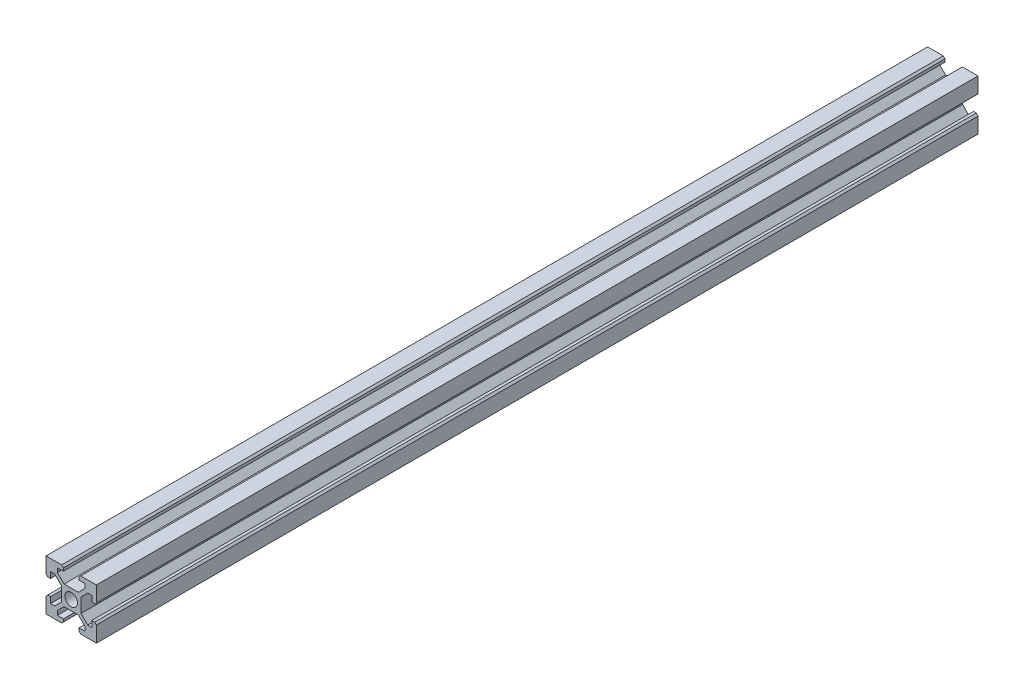
from build123d import *

# Parameters (mm, degrees)
SKETCH1_R           = 2.5
BOSS_EXTRUDE1_DEPTH = 175


with BuildPart() as part:
    # Sketch1 → Boss-Extrude1 (new, symmetric)
    with BuildSketch(Plane.XY):
        Polygon((3.9, -2.839339828), (6.560660172, -5.5), (8.200660172, -5.5), (8.200660172, -3.1), (9.3, -3.1), (10, -3.8), (10, -10), (3.8, -10), (3.1, -9.3), (3.1, -8.200660172), (5.5, -8.200660172), (5.5, -6.560660172), (2.839339828, -3.9), (-2.839339828, -3.9), (-5.5, -6.560660172), (-5.5, -8.200660172), (-3.1, -8.200660172), (-3.1, -9.3), (-3.8, -10), (-10, -10), (-10, -3.8), (-9.3, -3.1), (-8.200660172, -3.1), (-8.200660172, -5.5), (-6.560660172, -5.5), (-3.9, -2.839339828), (-3.9, 2.839339828), (-6.560660172, 5.5), (-8.200660172, 5.5), (-8.200660172, 3.1), (-9.3, 3.1), (-10, 3.8), (-10, 10), (-3.8, 10), (-3.1, 9.3), (-3.1, 8.200660172), (-5.5, 8.200660172), (-5.5, 6.560660172), (-2.839339828, 3.9), (2.839339828, 3.9), (5.5, 6.560660172), (5.5, 8.200660172), (3.1, 8.200660172), (3.1, 9.3), (3.8, 10), (10, 10), (10, 3.8), (9.3, 3.1), (8.200660172, 3.1), (8.200660172, 5.5), (6.560660172, 5.5), (3.9, 2.839339828), align=None)
        Circle(SKETCH1_R, mode=Mode.SUBTRACT)
    extrude(amount=BOSS_EXTRUDE1_DEPTH, both=True)


solid = part.part
